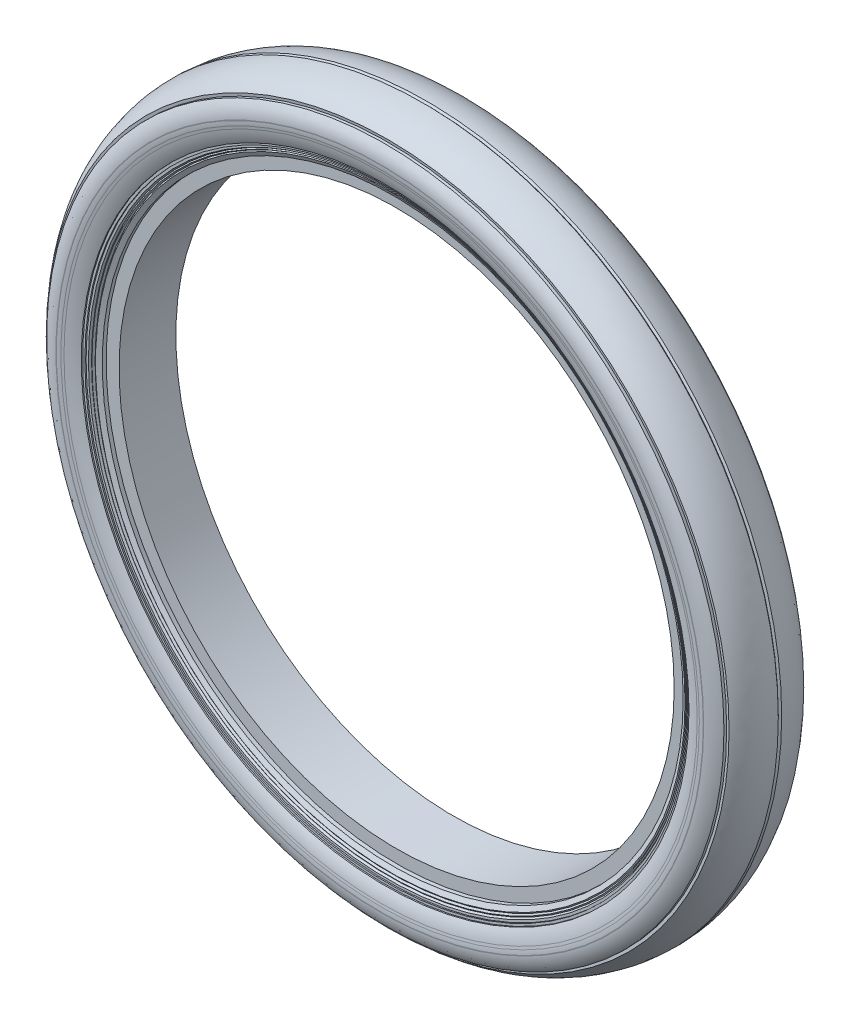
from build123d import *


with BuildPart() as part:
    # Эскиз2 → Повернуть1 (revolve)
    with BuildSketch(Plane(origin=(0, 0, 0), x_dir=(0, 0, -1), z_dir=(1, 0, 0)), mode=Mode.PRIVATE) as revolve_1_sk:
        with BuildLine():
            Line((0, 273.669789948), (-1.313227763, 274.983017711))
            add(Edge.make_bspline(
                [(-1.313227763, 274.983017711), (-18.97703865, 274.526009967), (-28.927587945, 264.459110615)],
                knots=[4.749918583, 4.749918583, 4.749918583, 5.685255053, 5.685255053, 5.685255053], degree=2, weights=[1, 0.892621888, 1]))
            Line((-28.927587945, 264.459110615), (-28.666473811, 262.350256404))
            Line((-28.666473811, 262.350256404), (-30.790209286, 262.350256404))
            add(Edge.make_bspline(
                [(-30.790209286, 262.350256404), (-35, 256.983356638), (-35, 250.882667615)],
                knots=[5.787662554, 5.787662554, 5.787662554, 6.283185307, 6.283185307, 6.283185307], degree=2, weights=[1, 0.969463838, 1]))
            Line((-35, 250.882667615), (-35, 250.537268265))
            ThreePointArc((-35, 250.537268265), (-34.931906754, 248.888300971), (-34.728090687, 247.250562031))
            Line((-34.728090687, 247.250562031), (-34.395586658, 245.254743371))
            ThreePointArc((-34.395586658, 245.254743371), (-33.077831675, 240.156872904), (-30.889076168, 235.367915727))
            Line((-30.889076168, 235.367915727), (-29.889076168, 235.367915727))
            Line((-29.889076168, 235.367915727), (-29.889076168, 233.607382253))
            Line((-29.889076168, 233.607382253), (-28.889076168, 233.607382253))
            Line((-28.889076168, 233.607382253), (-28.889076168, 231.846848779))
            Line((-28.889076168, 231.846848779), (-27.376943146, 230.94522145))
            Line((-27.376943146, 230.94522145), (-27.889076168, 230.086315304))
            Line((-27.889076168, 230.086315304), (-26.376943146, 229.184687976))
            Line((-26.376943146, 229.184687976), (-26.889076168, 228.32578183))
            Line((-26.889076168, 228.32578183), (-25, 225))
            Line((-25, 225), (-22, 225))
            Line((-22, 225), (-22, 215))
            Line((-22, 215), (22, 215))
            Line((22, 215), (22, 225))
            Line((22, 225), (25, 225))
            Line((25, 225), (26.889076168, 228.32578183))
            Line((26.889076168, 228.32578183), (26.376943146, 229.184687976))
            Line((26.376943146, 229.184687976), (27.889076168, 230.086315304))
            Line((27.889076168, 230.086315304), (27.376943146, 230.94522145))
            Line((27.376943146, 230.94522145), (28.889076168, 231.846848779))
            Line((28.889076168, 231.846848779), (28.889076168, 233.607382253))
            Line((28.889076168, 233.607382253), (29.889076168, 233.607382253))
            Line((29.889076168, 233.607382253), (29.889076168, 235.367915727))
            Line((29.889076168, 235.367915727), (30.889076168, 235.367915727))
            ThreePointArc((30.889076168, 235.367915727), (33.077831675, 240.156872904), (34.395586658, 245.254743371))
            Line((34.395586658, 245.254743371), (34.728090687, 247.250562031))
            ThreePointArc((34.728090687, 247.250562031), (34.931906754, 248.888300971), (35, 250.537268265))
            Line((35, 250.537268265), (35, 250.882667615))
            add(Edge.make_bspline(
                [(35, 250.882667615), (35, 256.983356638), (30.790209286, 262.350256404)],
                knots=[3.141592654, 3.141592654, 3.141592654, 3.637115407, 3.637115407, 3.637115407], degree=2, weights=[1, 0.969463838, 1]))
            Line((30.790209286, 262.350256404), (28.666473811, 262.350256404))
            Line((28.666473811, 262.350256404), (28.927587945, 264.459110615))
            add(Edge.make_bspline(
                [(28.927587945, 264.459110615), (18.97703865, 274.526009967), (1.313227763, 274.983017711)],
                knots=[3.739522908, 3.739522908, 3.739522908, 4.674859378, 4.674859378, 4.674859378], degree=2, weights=[1, 0.892621888, 1]))
            Line((1.313227763, 274.983017711), (0, 273.669789948))
        make_face()
    revolve(revolve_1_sk.sketch.rotate(Axis((0, 0, 22), (0, 0, -1)), 90), axis=Axis((0, 0, 22), (0, 0, -1)))


solid = part.part
